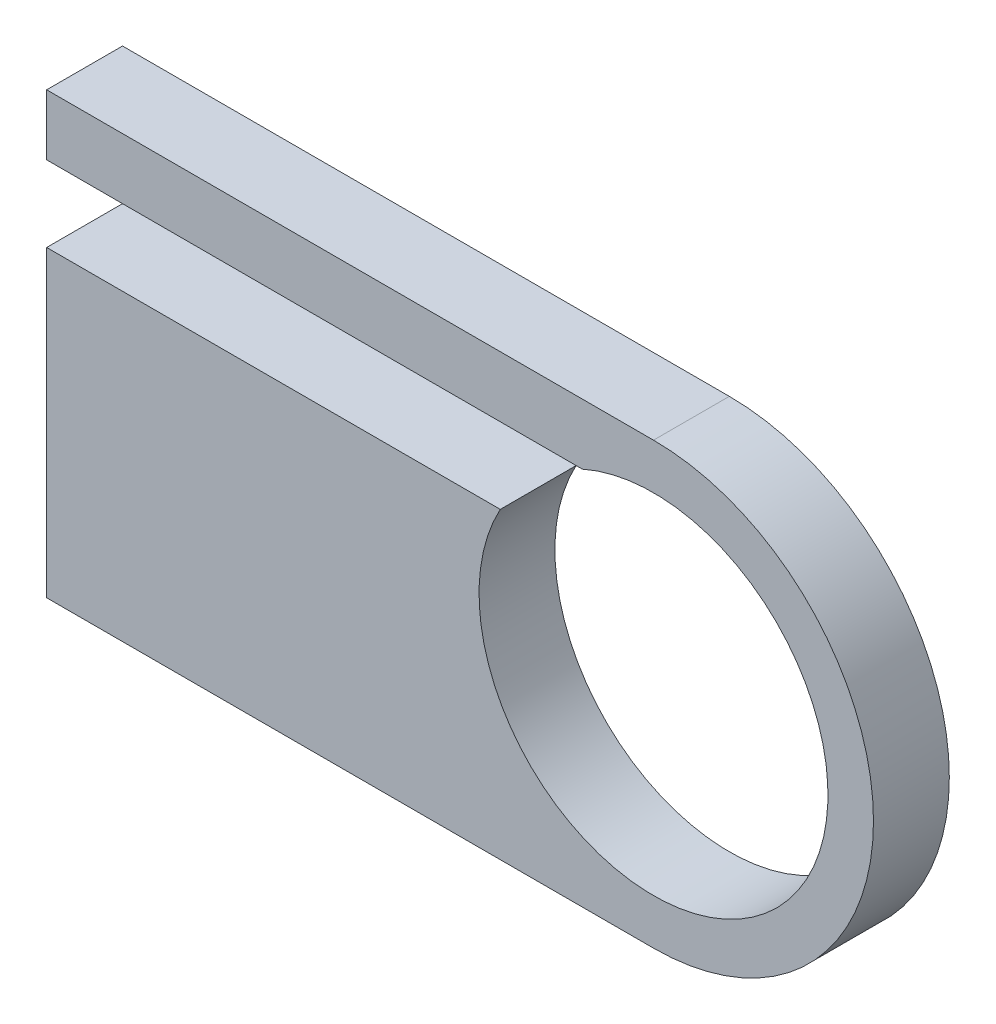
from build123d import *

# Parameters (mm, degrees)
BOSS_EXTRUDE1_DEPTH = 5


with BuildPart() as part:
    # Sketch1 → Boss-Extrude1 (new body)
    with BuildSketch(Plane.XY):
        with BuildLine():
            Line((0, 0), (0, 4))
            Line((0, 4), (40, 4))
            ThreePointArc((40, 4), (54.5, -10.5), (40, -25))
            Line((40, -25), (0, -25))
            Line((0, -25), (0, -5))
            Line((0, -5), (29.900495062, -5))
            ThreePointArc((29.900495062, -5), (47.806115459, -18.944794932), (35.30958424, 0))
            Line((35.30958424, 0), (0, 0))
        make_face()
    extrude(amount=BOSS_EXTRUDE1_DEPTH)


solid = part.part
